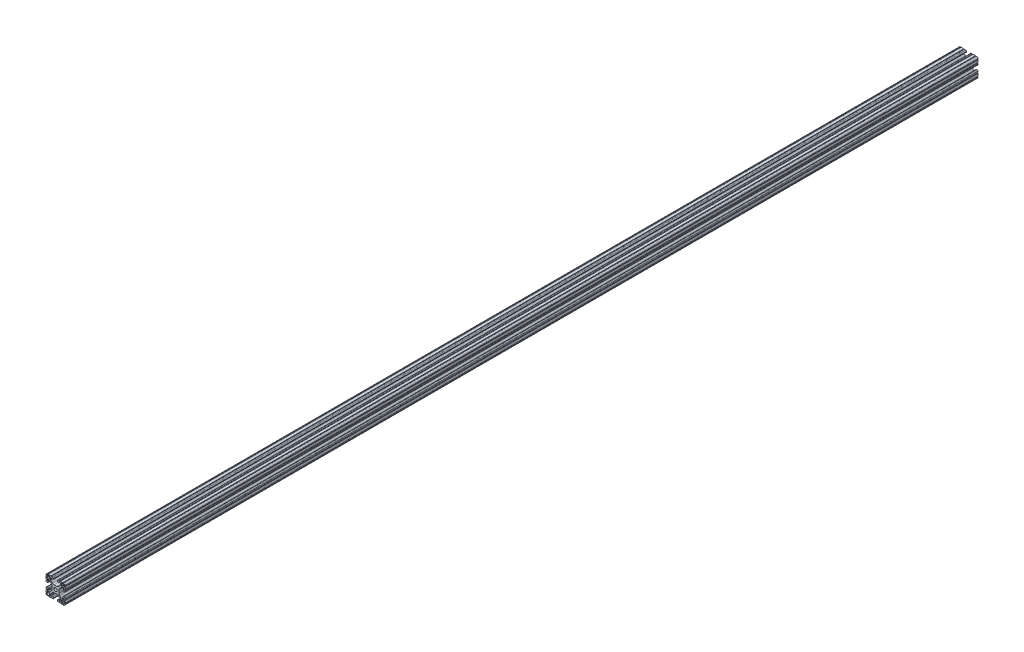
from build123d import *

# Parameters (mm, degrees)
BOSS_EXTRUDE1_DEPTH     = 914.4
CUT_EXTRUDE2_DEPTH      = 915.79678891
CUT_EXTRUDE2_DEPTH_BACK = 915.79678891
CUT_EXTRUDE1_DEPTH      = 915.796290089
CUT_EXTRUDE1_DEPTH_BACK = 915.796290089


with BuildPart() as part:
    # Sketch4 → Boss-Extrude1 (new, symmetric)
    with BuildSketch(Plane.XY):
        with BuildLine():
            Line((15.764194098, -19.048065876), (5.596097049, -18.692988103))
            ThreePointArc((5.596097049, -18.692988103), (4.509548067, -18.209225328), (4.064, -17.106455165))
            Line((4.064, -17.106455165), (4.064, -16.343990692))
            ThreePointArc((4.064, -16.343990692), (4.548729837, -15.202038759), (5.706902951, -14.757457754))
            Line((5.706902951, -14.757457754), (6.490296708, -14.784814467))
            ThreePointArc((6.490296708, -14.784814467), (6.751068464, -14.900917533), (6.858, -15.165582372))
            Line((6.858, -15.165582372), (6.858, -15.689138401))
            ThreePointArc((6.858, -15.689138401), (6.964931536, -15.95380324), (7.225703292, -16.069906306))
            Line((7.225703292, -16.069906306), (9.465548524, -16.148123425))
            ThreePointArc((9.465548524, -16.148123425), (10.044635082, -15.925832923), (10.287, -15.354856956))
            Line((10.287, -15.354856956), (10.287, -12.771043484))
            ThreePointArc((10.287, -12.771043484), (10.226579379, -12.46728851), (10.054516008, -12.209777477))
            Line((10.054516008, -12.209777477), (6.093922742, -8.249184211))
            ThreePointArc((6.093922742, -8.249184211), (4.552976719, -7.219556996), (2.735306952, -6.858))
            Line((2.735306952, -6.858), (0, -6.858))
            Line((0, -6.858), (0, -3.2639))
            ThreePointArc((0, -3.2639), (2.307925823, -2.307925823), (3.2639, 0))
            Line((3.2639, 0), (6.858, 0))
            Line((6.858, 0), (6.858, -2.735306952))
            ThreePointArc((6.858, -2.735306952), (7.219556996, -4.552976719), (8.249184211, -6.093922742))
            Line((8.249184211, -6.093922742), (12.209777477, -10.054516008))
            ThreePointArc((12.209777477, -10.054516008), (12.46728851, -10.226579379), (12.771043484, -10.287))
            Line((12.771043484, -10.287), (15.354856956, -10.287))
            ThreePointArc((15.354856956, -10.287), (15.925832923, -10.044635082), (16.148123425, -9.465548524))
            Line((16.148123425, -9.465548524), (16.069906306, -7.225703292))
            ThreePointArc((16.069906306, -7.225703292), (15.95380324, -6.964931536), (15.689138401, -6.858))
            Line((15.689138401, -6.858), (15.165582372, -6.858))
            ThreePointArc((15.165582372, -6.858), (14.900917533, -6.751068464), (14.784814467, -6.490296708))
            Line((14.784814467, -6.490296708), (14.757457754, -5.706902951))
            ThreePointArc((14.757457754, -5.706902951), (15.202038759, -4.548729837), (16.343990692, -4.064))
            Line((16.343990692, -4.064), (17.106455165, -4.064))
            ThreePointArc((17.106455165, -4.064), (18.209225328, -4.509548067), (18.692988103, -5.596097049))
            Line((18.692988103, -5.596097049), (19.048065876, -15.764194098))
            ThreePointArc((19.048065876, -15.764194098), (18.12006403, -18.12006403), (15.764194098, -19.048065876))
        make_face()
        with BuildLine():
            Line((11.8872, -12.2682), (11.8872, -16.943575443))
            ThreePointArc((11.8872, -16.943575443), (11.994131536, -17.208240282), (12.254903292, -17.324343348))
            Line((12.254903292, -17.324343348), (14.445350862, -17.400835462))
            ThreePointArc((14.445350862, -17.400835462), (16.565633801, -16.565633801), (17.400835462, -14.445350862))
            Line((17.400835462, -14.445350862), (17.324343348, -12.254903292))
            ThreePointArc((17.324343348, -12.254903292), (17.208240282, -11.994131536), (16.943575443, -11.8872))
            Line((16.943575443, -11.8872), (12.2682, -11.8872))
            ThreePointArc((12.2682, -11.8872), (11.998792316, -11.998792316), (11.8872, -12.2682))
        make_face(mode=Mode.SUBTRACT)
    extrude(amount=BOSS_EXTRUDE1_DEPTH, both=True)

    # Sketch8 → Cut-Extrude2 (cut, two sides: drawn at the far end of the back side and taken through both)
    with BuildSketch(Plane.XY.offset(-CUT_EXTRUDE2_DEPTH_BACK)):
        with BuildLine():
            Line((7.649186899, -18.76468358), (9.495813101, -18.829169188))
            Line((9.495813101, -18.829169188), (9.278946369, -18.421302187))
            ThreePointArc((9.278946369, -18.421302187), (8.600423087, -17.997313783), (7.893976718, -18.372937981))
            Line((7.893976718, -18.372937981), (7.649186899, -18.76468358))
        make_face()
        with BuildLine():
            Line((14.316686899, -18.997517811), (16.163313101, -19.062003418))
            Line((16.163313101, -19.062003418), (15.946446369, -18.654136417))
            ThreePointArc((15.946446369, -18.654136417), (15.267923087, -18.230148014), (14.561476718, -18.605772211))
            Line((14.561476718, -18.605772211), (14.316686899, -18.997517811))
        make_face()
        with BuildLine():
            Line((18.605772211, -14.561476718), (18.997517811, -14.316686899))
            Line((18.997517811, -14.316686899), (19.062003418, -16.163313101))
            Line((19.062003418, -16.163313101), (18.654136417, -15.946446369))
            ThreePointArc((18.654136417, -15.946446369), (18.230148014, -15.267923087), (18.605772211, -14.561476718))
        make_face()
        with BuildLine():
            Line((18.372937981, -7.893976718), (18.76468358, -7.649186899))
            Line((18.76468358, -7.649186899), (18.829169188, -9.495813101))
            Line((18.829169188, -9.495813101), (18.421302187, -9.278946369))
            ThreePointArc((18.421302187, -9.278946369), (17.997313783, -8.600423087), (18.372937981, -7.893976718))
        make_face()
    extrude(amount=CUT_EXTRUDE2_DEPTH + CUT_EXTRUDE2_DEPTH_BACK, mode=Mode.SUBTRACT)

    # Mirror1: part across plane


with BuildPart() as part_1:
    add(part.part)
    add(part.part.mirror(Plane(origin=(0, 0, 0), x_dir=(0, 0, 1), z_dir=(1, 0, 0))))

    # Mirror2: part across plane


with BuildPart() as part_2:
    add(part_1.part)
    add(part_1.part.mirror(Plane.ZX))

    # Sketch5 → Cut-Extrude1 (cut, two sides: drawn at the far end of the back side and taken through both)
    with BuildSketch(Plane.XY.offset(-CUT_EXTRUDE1_DEPTH_BACK)):
        with BuildLine():
            Line((-10.133783723, 12.50797511), (-10.133783723, 11.99997511))
            ThreePointArc((-10.133783723, 11.99997511), (-10.084187138, 11.880238362), (-9.964450389, 11.830641777))
            Line((-9.964450389, 11.830641777), (-9.650582015, 11.830641777))
            Line((-9.650582015, 11.830641777), (-9.650582015, 12.50797511))
            Line((-9.650582015, 12.50797511), (-10.133783723, 12.50797511))
        make_face()
    extrude(amount=CUT_EXTRUDE1_DEPTH + CUT_EXTRUDE1_DEPTH_BACK, mode=Mode.SUBTRACT)


solid = part_2.part
